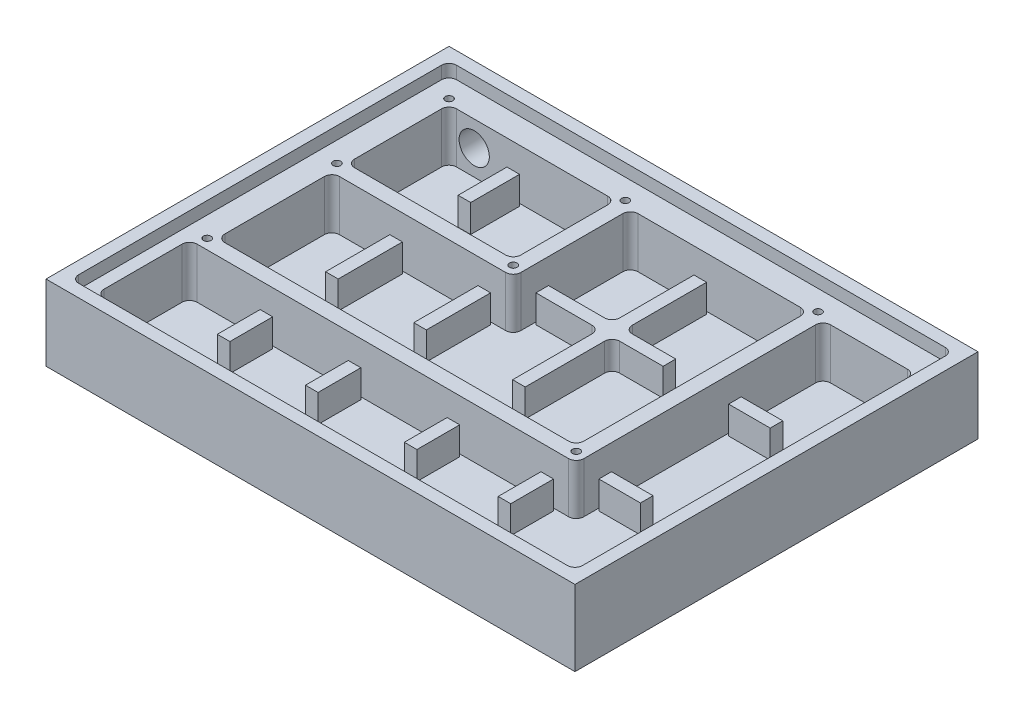
from build123d import *

# Parameters (mm, degrees)
SKETCH1_W             = 210
SKETCH1_H             = 160
BOSS_EXTRUDE1_DEPTH   = 30
SKETCH9_W             = 200
SKETCH9_H             = 150
CUT_EXTRUDE3_DEPTH    = 5
SKETCH3_R             = 1.5
CUT_EXTRUDE1_DEPTH    = 10
SKETCH12_W            = 190
SKETCH12_H            = 140
CUT_EXTRUDE4_DEPTH    = 25
SKETCH13_W            = 78
SKETCH13_H            = 52.5
SKETCH13_W_2          = 66
SKETCH13_H_2          = 40.5
EXTRUDE_THIN1_DEPTH   = 25
EXTRUDE_THIN2_DEPTH   = 25
SKETCH15_R            = 1.5
CUT_EXTRUDE5_DEPTH    = 10
BOSS_EXTRUDE2_REACH   = 136.35
SKETCH16_W            = 36.5
SKETCH16_H            = 5
FILLET1_R             = 3
FILLET2_R             = 3
FILLET3_R             = 3
CUT_EXTRUDE6_REACH    = 195.714
SKETCH17_R            = 6
SKETCH18_W            = 5
SKETCH18_H            = 72
EXTRUDE_THIN3_DEPTH   = 11
SKETCH18_H_2          = 25.5
EXTRUDE_THIN3_2_DEPTH = 11
SKETCH18_H_3          = 17
EXTRUDE_THIN3_3_DEPTH = 11
SKETCH18_H_4          = 19.393234672
EXTRUDE_THIN3_4_DEPTH = 11
EXTRUDE_THIN3_5_DEPTH = 11
EXTRUDE_THIN3_6_DEPTH = 11
EXTRUDE_THIN3_7_DEPTH = 11
EXTRUDE_THIN3_8_DEPTH = 11
SKETCH19_W            = 50.5
SKETCH19_H            = 5
SKETCH19_W_2          = 16.5
EXTRUDE_THIN4_DEPTH   = 11
FILLET4_R             = 3


with BuildPart() as part:
    # Sketch1 → Boss-Extrude1 (new body)
    with BuildSketch(Plane(origin=(0, 0, 0), x_dir=(1, 0, 0), z_dir=(0, 1, 0))):
        Rectangle(SKETCH1_W, SKETCH1_H)
    extrude(amount=BOSS_EXTRUDE1_DEPTH)

    # Sketch9 → Cut-Extrude3 (cut)
    with BuildSketch(Plane(origin=(0, 30, 0), x_dir=(1, 0, 0), z_dir=(0, 1, 0))):
        Rectangle(SKETCH9_W, SKETCH9_H)
    extrude(amount=-CUT_EXTRUDE3_DEPTH, mode=Mode.SUBTRACT)

    # Sketch3 → Cut-Extrude1 (cut)
    with BuildSketch(Plane(origin=(0, 30, 0), x_dir=(1, 0, 0), z_dir=(0, 1, 0))):
        with Locations(Location((-92, 67, 0), (0, 0, 270))):
            Circle(SKETCH3_R)
        with Locations(Location((-22, 67, 0), (0, 0, 270))):
            Circle(SKETCH3_R)
        with Locations(Location((-92, 22.5, 0), (0, 0, 270))):
            Circle(SKETCH3_R)
        with Locations(Location((-22, 22.5, 0), (0, 0, 270))):
            Circle(SKETCH3_R)
    extrude(amount=-CUT_EXTRUDE1_DEPTH, mode=Mode.SUBTRACT)

    # Sketch12 → Cut-Extrude4 (cut)
    with BuildSketch(Plane(origin=(0, 30, 0), x_dir=(1, 0, 0), z_dir=(0, 1, 0))):
        Rectangle(SKETCH12_W, SKETCH12_H)
    extrude(amount=-CUT_EXTRUDE4_DEPTH, mode=Mode.SUBTRACT)

    # Sketch13 → Extrude-Thin1 (add)
    with BuildSketch(Plane(origin=(0, 25, 0), x_dir=(1, 0, 0), z_dir=(0, 1, 0))):
        with Locations((-57, 44.75)):
            Rectangle(SKETCH13_W, SKETCH13_H)
        with Locations((-57, 44.75)):
            Rectangle(SKETCH13_W_2, SKETCH13_H_2, mode=Mode.SUBTRACT)
    extrude(amount=-EXTRUDE_THIN1_DEPTH)

    # Sketch14 → Extrude-Thin2 (add)
    with BuildSketch(Plane(origin=(0, 25, 0), x_dir=(1, 0, 0), z_dir=(0, 1, 0))):
        Polygon((-90, 19.5), (-90, -27), (52.5, -27), (52.5, 65), (-19, 65), (-19, 71), (58.5, 71), (58.5, -33), (-96, -33), (-96, 19.5), align=None)
    extrude(amount=-EXTRUDE_THIN2_DEPTH)

    # Sketch15 → Cut-Extrude5 (cut)
    with BuildSketch(Plane(origin=(0, 25, 0), x_dir=(1, 0, 0), z_dir=(0, 1, 0))):
        with Locations(Location((54.5, 67, 0), (0, 0, 270))):
            Circle(SKETCH15_R)
        with Locations(Location((-92, -29, 0), (0, 0, 270))):
            Circle(SKETCH15_R)
        with Locations(Location((54.5, -29, 0), (0, 0, 270))):
            Circle(SKETCH15_R)
        with Locations(Location((-92, 67, 0), (0, 0, 270))):
            Circle(SKETCH15_R)
        with Locations(Location((-92, 22.5, 0), (0, 0, 270))):
            Circle(SKETCH15_R)
        with Locations(Location((-22, 22.5, 0), (0, 0, 270))):
            Circle(SKETCH15_R)
        with Locations(Location((-22, 67, 0), (0, 0, 270))):
            Circle(SKETCH15_R)
    extrude(amount=-CUT_EXTRUDE5_DEPTH, mode=Mode.SUBTRACT)

    # Sketch16 → Boss-Extrude2 (add, up to next)
    with BuildSketch(Plane(origin=(0, 25, 0), x_dir=(1, 0, 0), z_dir=(0, 1, 0)), mode=Mode.PRIVATE) as boss_extrude2_sk1:
        with Locations((76.75, 67.5)):
            Rectangle(SKETCH16_W, SKETCH16_H)
    boss_extrude2_tool1 = extrude(boss_extrude2_sk1.sketch, amount=-BOSS_EXTRUDE2_REACH, mode=Mode.PRIVATE) - part.part
    add(boss_extrude2_tool1.solids().sort_by_distance((76.75, 25, -67.5))[0])

    # Fillet1
    fillet1_edges = [part.edges().sort_by_distance(p)[0] for p in [
        (-90, 15, -18.5),
        (-18, 15, -65),
        (-95, 15, 33),
        (-90, 15, 27),
        (52.5, 15, 27),
        (52.5, 15, -65),
        (95, 15, -65),
        (58.5, 15, -65),
        (-95, 15, 70),
        (95, 15, 70),
        (-90, 15, -65),
        (-24, 15, -65),
        (-24, 15, -24.5),
        (-90, 15, -24.5),
    ]]
    fillet(fillet1_edges, radius=FILLET1_R)

    # Fillet2
    fillet2_edges = [part.edges().sort_by_distance(p)[0] for p in [
        (58.5, 15, 33),
        (-18, 15, -18.5),
    ]]
    fillet(fillet2_edges, radius=FILLET2_R)

    # Fillet3
    fillet3_edges = [part.edges().sort_by_distance(p)[0] for p in [
        (-100, 27.5, 75),
        (-100, 27.5, -75),
        (100, 27.5, -75),
        (100, 27.5, 75),
    ]]
    fillet(fillet3_edges, radius=FILLET3_R)

    # Sketch17 → Cut-Extrude6 (cut, up to next)
    with BuildSketch(Plane(origin=(0, 0, -80), x_dir=(-1, 0, 0), z_dir=(0, 0, -1)), mode=Mode.PRIVATE) as cut_extrude6_sk1:
        with Locations((80, 15)):
            Circle(SKETCH17_R)
    cut_extrude6_tool1 = extrude(cut_extrude6_sk1.sketch, amount=-CUT_EXTRUDE6_REACH, mode=Mode.PRIVATE) & part.part
    add(cut_extrude6_tool1.solids().sort_by_distance((-80, 15, -80))[0], mode=Mode.SUBTRACT)


with BuildPart() as body_2:
    # Sketch18 → Extrude-Thin3 (new body)
    with BuildSketch(Plane(origin=(0, 25, 0), x_dir=(1, 0, 0), z_dir=(0, 1, 0))):
        with Locations((19.75, 19)):
            Rectangle(SKETCH18_W, SKETCH18_H)
    extrude(amount=-EXTRUDE_THIN3_DEPTH)

    # Sketch19 → Extrude-Thin4 (add)
    with BuildSketch(Plane(origin=(0, 25, 0), x_dir=(1, 0, 0), z_dir=(0, 1, 0))):
        with Locations((17.25, 20)):
            Rectangle(SKETCH19_W, SKETCH19_H)
        with Locations((76.75, 20)):
            Rectangle(SKETCH19_W_2, SKETCH19_H)
        with Locations((76.75, -31.5)):
            Rectangle(SKETCH19_W_2, SKETCH19_H)
    extrude(amount=-EXTRUDE_THIN4_DEPTH)


with BuildPart() as body_3:
    # Sketch18 → Extrude-Thin3 2 (new body)
    with BuildSketch(Plane(origin=(0, 25, 0), x_dir=(1, 0, 0), z_dir=(0, 1, 0))):
        with Locations((-19.5, -4.25)):
            Rectangle(SKETCH18_W, SKETCH18_H_2)
    extrude(amount=-EXTRUDE_THIN3_2_DEPTH)


with BuildPart() as body_4:
    # Sketch18 → Extrude-Thin3 3 (new body)
    with BuildSketch(Plane(origin=(0, 25, 0), x_dir=(1, 0, 0), z_dir=(0, 1, 0))):
        with Locations((57, -51.5)):
            Rectangle(SKETCH18_W, SKETCH18_H_3)
    extrude(amount=-EXTRUDE_THIN3_3_DEPTH)


with BuildPart() as body_5:
    # Sketch18 → Extrude-Thin3 4 (new body)
    with BuildSketch(Plane(origin=(0, 25, 0), x_dir=(1, 0, 0), z_dir=(0, 1, 0))):
        with Locations((-54.5, 45.303382664)):
            Rectangle(SKETCH18_W, SKETCH18_H_4)
    extrude(amount=-EXTRUDE_THIN3_4_DEPTH)


with BuildPart() as body_6:
    # Sketch18 → Extrude-Thin3 5 (new body)
    with BuildSketch(Plane(origin=(0, 25, 0), x_dir=(1, 0, 0), z_dir=(0, 1, 0))):
        with Locations((-19.5, -51.5)):
            Rectangle(SKETCH18_W, SKETCH18_H_3)
    extrude(amount=-EXTRUDE_THIN3_5_DEPTH)


with BuildPart() as body_7:
    # Sketch18 → Extrude-Thin3 6 (new body)
    with BuildSketch(Plane(origin=(0, 25, 0), x_dir=(1, 0, 0), z_dir=(0, 1, 0))):
        with Locations((19.75, -51.5)):
            Rectangle(SKETCH18_W, SKETCH18_H_3)
    extrude(amount=-EXTRUDE_THIN3_6_DEPTH)


with BuildPart() as body_8:
    # Sketch18 → Extrude-Thin3 7 (new body)
    with BuildSketch(Plane(origin=(0, 25, 0), x_dir=(1, 0, 0), z_dir=(0, 1, 0))):
        with Locations((-54.5, -4.25)):
            Rectangle(SKETCH18_W, SKETCH18_H_2)
    extrude(amount=-EXTRUDE_THIN3_7_DEPTH)


with BuildPart() as body_9:
    # Sketch18 → Extrude-Thin3 8 (new body)
    with BuildSketch(Plane(origin=(0, 25, 0), x_dir=(1, 0, 0), z_dir=(0, 1, 0))):
        with Locations((-54.5, -51.5)):
            Rectangle(SKETCH18_W, SKETCH18_H_3)
    extrude(amount=-EXTRUDE_THIN3_8_DEPTH)


with BuildPart() as extrude_thin4_piece_1:
    # of the separate pieces the step leaves, piece 1, a body of its own (extrude_thin4_pieces)
    add(body_2.part.solids().sort_by_distance((17.25, 25, -55))[0])

    # Fillet4
    fillet4_edges = [extrude_thin4_piece_1.edges().sort_by_distance(p)[0] for p in [
        (22.25, 19.5, -17.5),
        (17.25, 19.5, -22.5),
        (22.25, 19.5, -22.5),
        (17.25, 19.5, -17.5),
    ]]
    fillet(fillet4_edges, radius=FILLET4_R)


with BuildPart() as extrude_thin4_piece_2:
    # of the separate pieces the step leaves, piece 2, a body of its own (extrude_thin4_pieces)
    add(body_2.part.solids().sort_by_distance((68.5, 25, 29))[0])


with BuildPart() as extrude_thin4_piece_3:
    # of the separate pieces the step leaves, piece 3, a body of its own (extrude_thin4_pieces)
    add(body_2.part.solids().sort_by_distance((68.5, 25, -22.5))[0])


solid = Compound([part.part, body_3.part, body_4.part, body_5.part, body_6.part, body_7.part, body_8.part, body_9.part, extrude_thin4_piece_1.part, extrude_thin4_piece_2.part, extrude_thin4_piece_3.part])
